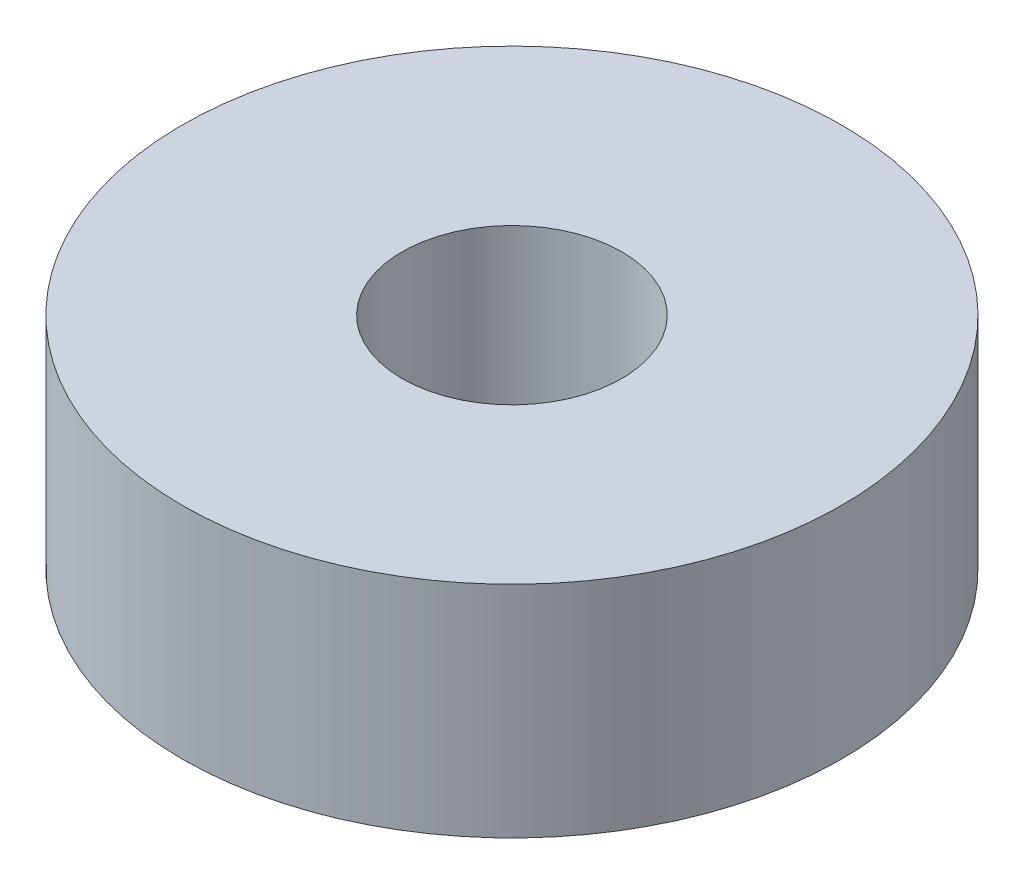
from build123d import *

# Parameters (mm, degrees)
SKETCH1_R           = 6
SKETCH1_R_2         = 2
BOSS_EXTRUDE1_DEPTH = 4


with BuildPart() as part:
    # Sketch1 → Boss-Extrude1 (new body)
    with BuildSketch(Plane(origin=(0, 0, 0), x_dir=(1, 0, 0), z_dir=(0, 1, 0))):
        with Locations(Location((0, 0, 0), (0, 0, 270))):
            Circle(SKETCH1_R)
        with Locations(Location((0, 0, 0), (0, 0, 270))):
            Circle(SKETCH1_R_2, mode=Mode.SUBTRACT)
    extrude(amount=BOSS_EXTRUDE1_DEPTH)


solid = part.part
